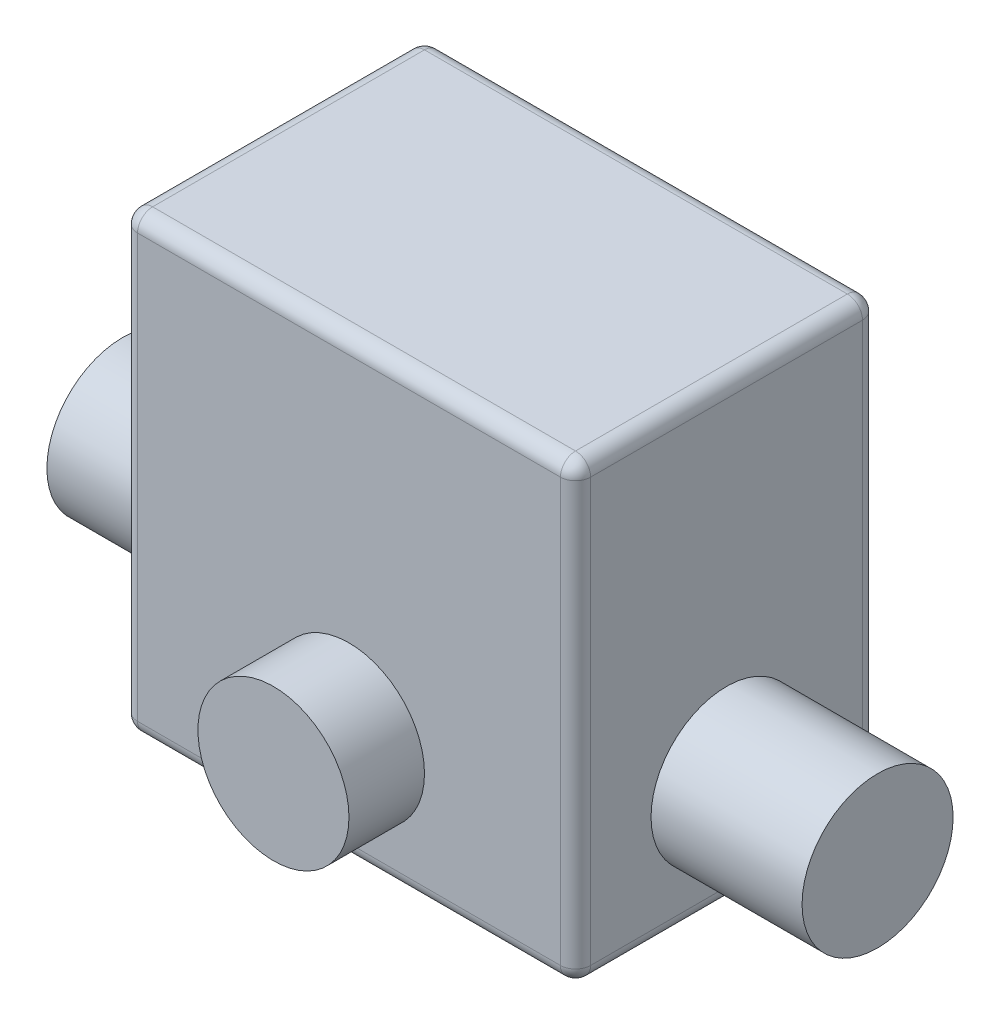
from build123d import *

# Parameters (mm, degrees)
SKETCH1_W           = 3
SKETCH1_H           = 3
BOSS_EXTRUDE1_DEPTH = 2
SKETCH3_R           = 0.5
BOSS_EXTRUDE2_DEPTH = 2.5
FILLET1_R           = 0.1
SKETCH4_R           = 0.5
BOSS_EXTRUDE3_DEPTH = 0.5


with BuildPart() as part:
    # Sketch1 → Boss-Extrude1 (new body)
    with BuildSketch(Plane.XY):
        with Locations((1.5, 1.5)):
            Rectangle(SKETCH1_W, SKETCH1_H)
    extrude(amount=BOSS_EXTRUDE1_DEPTH)

    # Sketch3 → Boss-Extrude2 (add, symmetric)
    with BuildSketch(Plane(origin=(1.5, 0, 0), x_dir=(0, 0, -1), z_dir=(1, 0, 0))):
        with Locations(Location((-1, 0.75, 0), (0, 0, 180))):
            Circle(SKETCH3_R)
    extrude(amount=BOSS_EXTRUDE2_DEPTH, both=True)

    # Fillet1
    fillet1_edges = [part.edges().sort_by_distance(p)[0] for p in [
        (1.5, 3, 2),
        (0, 1.5, 2),
        (1.5, 0, 2),
        (0, 1.5, 0),
        (1.5, 3, 0),
        (3, 1.5, 0),
        (1.5, 0, 0),
        (3, 1.5, 2),
        (0, 0, 1),
        (0, 3, 1),
        (3, 3, 1),
        (3, 0, 1),
    ]]
    fillet(fillet1_edges, radius=FILLET1_R)

    # Sketch4 → Boss-Extrude3 (add)
    with BuildSketch(Plane.XY.offset(2)):
        with Locations((1.5, 0.75)):
            Circle(SKETCH4_R)
    extrude(amount=BOSS_EXTRUDE3_DEPTH)


solid = part.part
